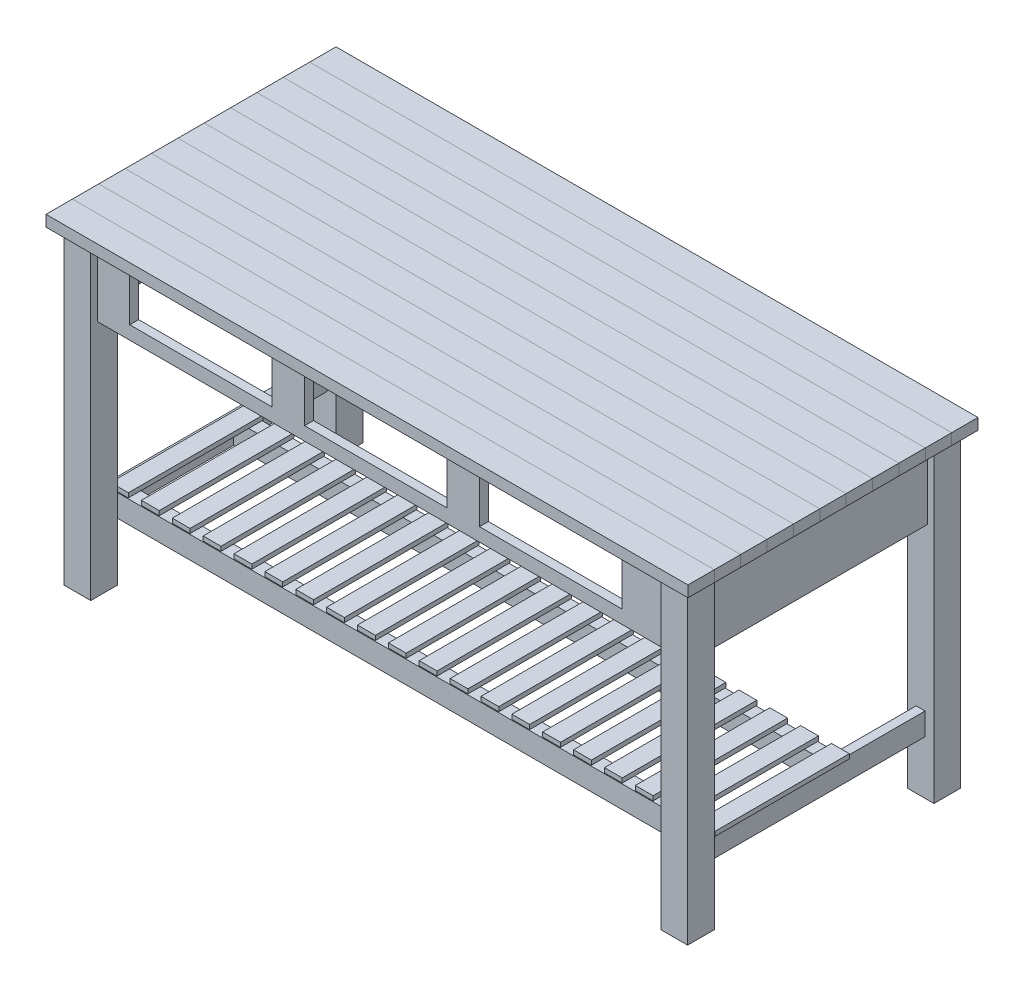
from build123d import *

# Parameters (mm, degrees)
SKETCH1_W                      = 1830.3875
SKETCH1_H                      = 75.184
TOP1_DEPTH                     = 31.75
SKETCH1_9_W                    = 1830.3875
SKETCH1_9_H                    = 75.184
TOP2_DEPTH                     = 31.75
SKETCH1_10_W                   = 1830.3875
SKETCH1_10_H                   = 75.184
TOP3_DEPTH                     = 31.75
SKETCH1_11_W                   = 1830.3875
SKETCH1_11_H                   = 75.184
TOP4_DEPTH                     = 31.75
SKETCH1_12_W                   = 1830.3875
SKETCH1_12_H                   = 75.184
TOP5_DEPTH                     = 31.75
SKETCH1_13_W                   = 1830.3875
SKETCH1_13_H                   = 75.184
TOP6_DEPTH                     = 31.75
SKETCH1_14_W                   = 1830.3875
SKETCH1_14_H                   = 75.184
TOP7_DEPTH                     = 31.75
SKETCH1_15_W                   = 1830.3875
SKETCH1_15_H                   = 75.184
TOP8_DEPTH                     = 31.75
SKETCH1_16_W                   = 1830.3875
SKETCH1_16_H                   = 75.184
TOP9_DEPTH                     = 31.75
SKETCH1_17_W                   = 1830.3875
SKETCH1_17_H                   = 75.184
TOP10_DEPTH                    = 31.75
SKETCH1_20_W                   = 1830.3875
SKETCH1_20_H                   = 75.184
TOP11_DEPTH                    = 31.75
SKETCH2_W                      = 76.2
SKETCH2_H                      = 76.2
TABLE_LEGS_DEPTH               = 882.65
TABLE_LEGS_2_DEPTH             = 882.65
TABLE_LEGS_3_DEPTH             = 882.65
TABLE_LEGS_4_DEPTH             = 882.65
SKETCH4_W                      = 25.4
SKETCH4_H                      = 63.5
STRETCHER_WIDTH_DEPTH          = 624.84
SKETCH5_W                      = 38.1
SKETCH5_H                      = 63.5
STRETCHER_LENGTH_DEPTH         = 1679.575
STRETCHER_LENGTH_2_DEPTH       = 1679.575
SKETCH7_W                      = 25.4
SKETCH7_H                      = 203.2
FRONT_FACE_PLATE_DEPTH         = 1625.6
SKETCH8_W                      = 25.4
SKETCH8_H                      = 203.2
SIDE_FACE_PLATES_DEPTH         = 624.84
SIDE_FACE_PLATES_2_DEPTH       = 624.84
SKETCH9_W                      = 50.8
SKETCH9_H                      = 12.7
STRETCHER_RACK_BOARDS_DEPTH    = 383.54
STRETCHER_RACK_BOARDS_2_DEPTH  = 383.54
STRETCHER_RACK_BOARDS_3_DEPTH  = 383.54
STRETCHER_RACK_BOARDS_4_DEPTH  = 383.54
STRETCHER_RACK_BOARDS_5_DEPTH  = 383.54
STRETCHER_RACK_BOARDS_6_DEPTH  = 383.54
STRETCHER_RACK_BOARDS_7_DEPTH  = 383.54
STRETCHER_RACK_BOARDS_8_DEPTH  = 383.54
STRETCHER_RACK_BOARDS_9_DEPTH  = 383.54
STRETCHER_RACK_BOARDS_10_DEPTH = 383.54
STRETCHER_RACK_BOARDS_11_DEPTH = 383.54
STRETCHER_RACK_BOARDS_12_DEPTH = 383.54
STRETCHER_RACK_BOARDS_13_DEPTH = 383.54
STRETCHER_RACK_BOARDS_14_DEPTH = 383.54
STRETCHER_RACK_BOARDS_15_DEPTH = 383.54
STRETCHER_RACK_BOARDS_16_DEPTH = 383.54
STRETCHER_RACK_BOARDS_17_DEPTH = 383.54
STRETCHER_RACK_BOARDS_18_DEPTH = 383.54
STRETCHER_RACK_BOARDS_19_DEPTH = 383.54
STRETCHER_RACK_BOARDS_20_DEPTH = 383.54
SKETCH10_W                     = 406.4
SKETCH10_H                     = 127
DRAWER_CUT_OUTS_DEPTH          = 25.4
SKETCH11_W                     = 25.4
SKETCH11_H                     = 101.6
BACK_FACE_PLATE_DEPTH          = 1628.775


with BuildPart() as part:
    # Sketch1 → top1 (new body)
    with BuildSketch(Plane(origin=(0, 0, 0), x_dir=(1, 0, 0), z_dir=(0, 1, 0))):
        with Locations((-0.79375, -99.862967742)):
            Rectangle(SKETCH1_W, SKETCH1_H)
    extrude(amount=TOP1_DEPTH)


with BuildPart() as body_2:
    # Sketch1<9> → top2 (new body)
    with BuildSketch(Plane(origin=(0, 0, 0), x_dir=(1, 0, 0), z_dir=(0, 1, 0))):
        with Locations((-0.79375, -24.678967742)):
            Rectangle(SKETCH1_9_W, SKETCH1_9_H)
    extrude(amount=TOP2_DEPTH)


with BuildPart() as body_3:
    # Sketch1<10> → top3 (new body)
    with BuildSketch(Plane(origin=(0, 0, 0), x_dir=(1, 0, 0), z_dir=(0, 1, 0))):
        with Locations((-0.79375, 50.505032258)):
            Rectangle(SKETCH1_10_W, SKETCH1_10_H)
    extrude(amount=TOP3_DEPTH)


with BuildPart() as body_4:
    # Sketch1<11> → top4 (new body)
    with BuildSketch(Plane(origin=(0, 0, 0), x_dir=(1, 0, 0), z_dir=(0, 1, 0))):
        with Locations((-0.79375, 125.689032258)):
            Rectangle(SKETCH1_11_W, SKETCH1_11_H)
    extrude(amount=TOP4_DEPTH)


with BuildPart() as body_5:
    # Sketch1<12> → top5 (new body)
    with BuildSketch(Plane(origin=(0, 0, 0), x_dir=(1, 0, 0), z_dir=(0, 1, 0))):
        with Locations((-0.79375, 200.873032258)):
            Rectangle(SKETCH1_12_W, SKETCH1_12_H)
    extrude(amount=TOP5_DEPTH)


with BuildPart() as body_6:
    # Sketch1<13> → top6 (new body)
    with BuildSketch(Plane(origin=(0, 0, 0), x_dir=(1, 0, 0), z_dir=(0, 1, 0))):
        with Locations((-0.79375, 276.057032258)):
            Rectangle(SKETCH1_13_W, SKETCH1_13_H)
    extrude(amount=TOP6_DEPTH)


with BuildPart() as body_7:
    # Sketch1<14> → top7 (new body)
    with BuildSketch(Plane(origin=(0, 0, 0), x_dir=(1, 0, 0), z_dir=(0, 1, 0))):
        with Locations((-0.79375, 351.241032258)):
            Rectangle(SKETCH1_14_W, SKETCH1_14_H)
    extrude(amount=TOP7_DEPTH)


with BuildPart() as body_8:
    # Sketch1<15> → top8 (new body)
    with BuildSketch(Plane(origin=(0, 0, 0), x_dir=(1, 0, 0), z_dir=(0, 1, 0))):
        with Locations((-0.79375, 426.425032258)):
            Rectangle(SKETCH1_15_W, SKETCH1_15_H)
    extrude(amount=TOP8_DEPTH)


with BuildPart() as body_9:
    # Sketch1<16> → top9 (new body)
    with BuildSketch(Plane(origin=(0, 0, 0), x_dir=(1, 0, 0), z_dir=(0, 1, 0))):
        with Locations((-0.79375, 501.609032258)):
            Rectangle(SKETCH1_16_W, SKETCH1_16_H)
    extrude(amount=TOP9_DEPTH)


with BuildPart() as body_10:
    # Sketch1<17> → top10 (new body)
    with BuildSketch(Plane(origin=(0, 0, 0), x_dir=(1, 0, 0), z_dir=(0, 1, 0))):
        with Locations((-0.79375, 576.793032258)):
            Rectangle(SKETCH1_17_W, SKETCH1_17_H)
    extrude(amount=TOP10_DEPTH)


with BuildPart() as body_11:
    # Sketch1<20> → top11 (new body)
    with BuildSketch(Plane(origin=(0, 0, 0), x_dir=(1, 0, 0), z_dir=(0, 1, 0))):
        with Locations((-0.79375, 651.977032258)):
            Rectangle(SKETCH1_20_W, SKETCH1_20_H)
    extrude(amount=TOP11_DEPTH)


with BuildPart() as body_12:
    # Sketch2 → table legs (new body)
    with BuildSketch(Plane(origin=(0, 0, 0), x_dir=(1, 0, 0), z_dir=(0, 1, 0))):
        with Locations((-850.9, -74.970967742)):
            Rectangle(SKETCH2_W, SKETCH2_H)
    extrude(amount=-TABLE_LEGS_DEPTH)


with BuildPart() as body_13:
    # Sketch2 → table legs 2 (new body)
    with BuildSketch(Plane(origin=(0, 0, 0), x_dir=(1, 0, 0), z_dir=(0, 1, 0))):
        with Locations((-852.4875, 626.069032258)):
            Rectangle(SKETCH2_W, SKETCH2_H)
    extrude(amount=-TABLE_LEGS_2_DEPTH)


with BuildPart() as body_14:
    # Sketch2 → table legs 3 (new body)
    with BuildSketch(Plane(origin=(0, 0, 0), x_dir=(1, 0, 0), z_dir=(0, 1, 0))):
        with Locations((852.4875, 626.069032258)):
            Rectangle(SKETCH2_W, SKETCH2_H)
    extrude(amount=-TABLE_LEGS_3_DEPTH)


with BuildPart() as body_15:
    # Sketch2 → table legs 4 (new body)
    with BuildSketch(Plane(origin=(0, 0, 0), x_dir=(1, 0, 0), z_dir=(0, 1, 0))):
        with Locations((850.9, -74.970967742)):
            Rectangle(SKETCH2_W, SKETCH2_H)
    extrude(amount=-TABLE_LEGS_4_DEPTH)


with BuildPart() as body_16:
    # Sketch4 → stretcher width (new body)
    with BuildSketch(Plane.XY.offset(-587.969032258)):
        with Locations((852.4875, -698.5)):
            Rectangle(SKETCH4_W, SKETCH4_H)
    stretcher_width = extrude(amount=STRETCHER_WIDTH_DEPTH)


with BuildPart() as body_12_1:
    add(body_12.part)

    add(body_13.part)  # Mirror4 merges body 13
    # Mirror4: stretcher width across plane
    add(stretcher_width.mirror(Plane(origin=(0, 0, 0), x_dir=(0, 0, 1), z_dir=(1, 0, 0))))


with BuildPart() as body_16_2:
    # Sketch5 → stretcher length (new body)
    with BuildSketch(Plane(origin=(-839.7875, 0, 0), x_dir=(0, 0, -1), z_dir=(1, 0, 0))):
        with Locations((-5.120967742, -698.5)):
            Rectangle(SKETCH5_W, SKETCH5_H)
    extrude(amount=STRETCHER_LENGTH_DEPTH)


with BuildPart() as body_17:
    # Sketch5 → stretcher length 2 (new body)
    with BuildSketch(Plane(origin=(-839.7875, 0, 0), x_dir=(0, 0, -1), z_dir=(1, 0, 0))):
        with Locations((340.319032258, -698.5)):
            Rectangle(SKETCH5_W, SKETCH5_H)
    extrude(amount=STRETCHER_LENGTH_2_DEPTH)


with BuildPart() as body_18:
    # Sketch7 → front face plate (new body)
    with BuildSketch(Plane(origin=(-812.8, 0, 0), x_dir=(0, 0, -1), z_dir=(1, 0, 0))):
        with Locations((-81.320967742, -101.6)):
            Rectangle(SKETCH7_W, SKETCH7_H)
    extrude(amount=FRONT_FACE_PLATE_DEPTH)

    # Sketch10 → drawer cut outs (cut)
    with BuildSketch(Plane.XY.offset(94.020967742)):
        with Locations((-517.525, -101.6)):
            Rectangle(SKETCH10_W, SKETCH10_H)
        with Locations((-18.923, -101.6)):
            Rectangle(SKETCH10_W, SKETCH10_H)
        with Locations((479.679, -101.6)):
            Rectangle(SKETCH10_W, SKETCH10_H)
    extrude(amount=-DRAWER_CUT_OUTS_DEPTH, mode=Mode.SUBTRACT)


with BuildPart() as body_19:
    # Sketch8 → side face plates (new body)
    with BuildSketch(Plane.XY.offset(-587.969032258)):
        with Locations((858.8375, -101.6)):
            Rectangle(SKETCH8_W, SKETCH8_H)
    extrude(amount=SIDE_FACE_PLATES_DEPTH)


with BuildPart() as body_20:
    # Sketch8 → side face plates 2 (new body)
    with BuildSketch(Plane.XY.offset(-587.969032258)):
        with Locations((-858.8375, -101.6)):
            Rectangle(SKETCH8_W, SKETCH8_H)
    extrude(amount=SIDE_FACE_PLATES_2_DEPTH)


with BuildPart() as body_21:
    # Sketch9 → stretcher rack boards (new body)
    with BuildSketch(Plane(origin=(0, 0, -359.369032258), x_dir=(-1, 0, 0), z_dir=(0, 0, -1))):
        with Locations((-764.404165617, -658.053375253)):
            Rectangle(SKETCH9_W, SKETCH9_H)
    extrude(amount=-STRETCHER_RACK_BOARDS_DEPTH)


with BuildPart() as body_22:
    # Sketch9 → stretcher rack boards 2 (new body)
    with BuildSketch(Plane(origin=(0, 0, -359.369032258), x_dir=(-1, 0, 0), z_dir=(0, 0, -1))):
        with Locations((-852.415165617, -658.053375253)):
            Rectangle(SKETCH9_W, SKETCH9_H)
    extrude(amount=-STRETCHER_RACK_BOARDS_2_DEPTH)


with BuildPart() as body_23:
    # Sketch9 → stretcher rack boards 3 (new body)
    with BuildSketch(Plane(origin=(0, 0, -359.369032258), x_dir=(-1, 0, 0), z_dir=(0, 0, -1))):
        with Locations((-676.393165617, -658.053375253)):
            Rectangle(SKETCH9_W, SKETCH9_H)
    extrude(amount=-STRETCHER_RACK_BOARDS_3_DEPTH)


with BuildPart() as body_24:
    # Sketch9 → stretcher rack boards 4 (new body)
    with BuildSketch(Plane(origin=(0, 0, -359.369032258), x_dir=(-1, 0, 0), z_dir=(0, 0, -1))):
        with Locations((-588.382165617, -658.053375253)):
            Rectangle(SKETCH9_W, SKETCH9_H)
    extrude(amount=-STRETCHER_RACK_BOARDS_4_DEPTH)


with BuildPart() as body_25:
    # Sketch9 → stretcher rack boards 5 (new body)
    with BuildSketch(Plane(origin=(0, 0, -359.369032258), x_dir=(-1, 0, 0), z_dir=(0, 0, -1))):
        with Locations((-500.371165617, -658.053375253)):
            Rectangle(SKETCH9_W, SKETCH9_H)
    extrude(amount=-STRETCHER_RACK_BOARDS_5_DEPTH)


with BuildPart() as body_26:
    # Sketch9 → stretcher rack boards 6 (new body)
    with BuildSketch(Plane(origin=(0, 0, -359.369032258), x_dir=(-1, 0, 0), z_dir=(0, 0, -1))):
        with Locations((-412.360165617, -658.053375253)):
            Rectangle(SKETCH9_W, SKETCH9_H)
    extrude(amount=-STRETCHER_RACK_BOARDS_6_DEPTH)


with BuildPart() as body_27:
    # Sketch9 → stretcher rack boards 7 (new body)
    with BuildSketch(Plane(origin=(0, 0, -359.369032258), x_dir=(-1, 0, 0), z_dir=(0, 0, -1))):
        with Locations((-324.349165617, -658.053375253)):
            Rectangle(SKETCH9_W, SKETCH9_H)
    extrude(amount=-STRETCHER_RACK_BOARDS_7_DEPTH)


with BuildPart() as body_28:
    # Sketch9 → stretcher rack boards 8 (new body)
    with BuildSketch(Plane(origin=(0, 0, -359.369032258), x_dir=(-1, 0, 0), z_dir=(0, 0, -1))):
        with Locations((-236.338165617, -658.053375253)):
            Rectangle(SKETCH9_W, SKETCH9_H)
    extrude(amount=-STRETCHER_RACK_BOARDS_8_DEPTH)


with BuildPart() as body_29:
    # Sketch9 → stretcher rack boards 9 (new body)
    with BuildSketch(Plane(origin=(0, 0, -359.369032258), x_dir=(-1, 0, 0), z_dir=(0, 0, -1))):
        with Locations((-148.327165617, -658.053375253)):
            Rectangle(SKETCH9_W, SKETCH9_H)
    extrude(amount=-STRETCHER_RACK_BOARDS_9_DEPTH)


with BuildPart() as body_30:
    # Sketch9 → stretcher rack boards 10 (new body)
    with BuildSketch(Plane(origin=(0, 0, -359.369032258), x_dir=(-1, 0, 0), z_dir=(0, 0, -1))):
        with Locations((-60.316165617, -658.053375253)):
            Rectangle(SKETCH9_W, SKETCH9_H)
    extrude(amount=-STRETCHER_RACK_BOARDS_10_DEPTH)


with BuildPart() as body_31:
    # Sketch9 → stretcher rack boards 11 (new body)
    with BuildSketch(Plane(origin=(0, 0, -359.369032258), x_dir=(-1, 0, 0), z_dir=(0, 0, -1))):
        with Locations((27.694834383, -658.053375253)):
            Rectangle(SKETCH9_W, SKETCH9_H)
    extrude(amount=-STRETCHER_RACK_BOARDS_11_DEPTH)


with BuildPart() as body_32:
    # Sketch9 → stretcher rack boards 12 (new body)
    with BuildSketch(Plane(origin=(0, 0, -359.369032258), x_dir=(-1, 0, 0), z_dir=(0, 0, -1))):
        with Locations((115.705834383, -658.053375253)):
            Rectangle(SKETCH9_W, SKETCH9_H)
    extrude(amount=-STRETCHER_RACK_BOARDS_12_DEPTH)


with BuildPart() as body_33:
    # Sketch9 → stretcher rack boards 13 (new body)
    with BuildSketch(Plane(origin=(0, 0, -359.369032258), x_dir=(-1, 0, 0), z_dir=(0, 0, -1))):
        with Locations((203.716834383, -658.053375253)):
            Rectangle(SKETCH9_W, SKETCH9_H)
    extrude(amount=-STRETCHER_RACK_BOARDS_13_DEPTH)


with BuildPart() as body_34:
    # Sketch9 → stretcher rack boards 14 (new body)
    with BuildSketch(Plane(origin=(0, 0, -359.369032258), x_dir=(-1, 0, 0), z_dir=(0, 0, -1))):
        with Locations((291.727834383, -658.053375253)):
            Rectangle(SKETCH9_W, SKETCH9_H)
    extrude(amount=-STRETCHER_RACK_BOARDS_14_DEPTH)


with BuildPart() as body_35:
    # Sketch9 → stretcher rack boards 15 (new body)
    with BuildSketch(Plane(origin=(0, 0, -359.369032258), x_dir=(-1, 0, 0), z_dir=(0, 0, -1))):
        with Locations((379.738834383, -658.053375253)):
            Rectangle(SKETCH9_W, SKETCH9_H)
    extrude(amount=-STRETCHER_RACK_BOARDS_15_DEPTH)


with BuildPart() as body_36:
    # Sketch9 → stretcher rack boards 16 (new body)
    with BuildSketch(Plane(origin=(0, 0, -359.369032258), x_dir=(-1, 0, 0), z_dir=(0, 0, -1))):
        with Locations((467.749834383, -658.053375253)):
            Rectangle(SKETCH9_W, SKETCH9_H)
    extrude(amount=-STRETCHER_RACK_BOARDS_16_DEPTH)


with BuildPart() as body_37:
    # Sketch9 → stretcher rack boards 17 (new body)
    with BuildSketch(Plane(origin=(0, 0, -359.369032258), x_dir=(-1, 0, 0), z_dir=(0, 0, -1))):
        with Locations((555.760834383, -658.053375253)):
            Rectangle(SKETCH9_W, SKETCH9_H)
    extrude(amount=-STRETCHER_RACK_BOARDS_17_DEPTH)


with BuildPart() as body_38:
    # Sketch9 → stretcher rack boards 18 (new body)
    with BuildSketch(Plane(origin=(0, 0, -359.369032258), x_dir=(-1, 0, 0), z_dir=(0, 0, -1))):
        with Locations((643.771834383, -658.053375253)):
            Rectangle(SKETCH9_W, SKETCH9_H)
    extrude(amount=-STRETCHER_RACK_BOARDS_18_DEPTH)


with BuildPart() as body_39:
    # Sketch9 → stretcher rack boards 19 (new body)
    with BuildSketch(Plane(origin=(0, 0, -359.369032258), x_dir=(-1, 0, 0), z_dir=(0, 0, -1))):
        with Locations((731.782834383, -658.053375253)):
            Rectangle(SKETCH9_W, SKETCH9_H)
    extrude(amount=-STRETCHER_RACK_BOARDS_19_DEPTH)


with BuildPart() as body_40:
    # Sketch9 → stretcher rack boards 20 (new body)
    with BuildSketch(Plane(origin=(0, 0, -359.369032258), x_dir=(-1, 0, 0), z_dir=(0, 0, -1))):
        with Locations((819.793834383, -658.053375253)):
            Rectangle(SKETCH9_W, SKETCH9_H)
    extrude(amount=-STRETCHER_RACK_BOARDS_20_DEPTH)


with BuildPart() as body_41:
    # Sketch11 → back face plate (new body)
    with BuildSketch(Plane(origin=(-814.3875, 0, 0), x_dir=(0, 0, -1), z_dir=(1, 0, 0))):
        with Locations((632.419032258, -50.8)):
            Rectangle(SKETCH11_W, SKETCH11_H)
    extrude(amount=BACK_FACE_PLATE_DEPTH)


solid = Compound([part.part, body_2.part, body_3.part, body_4.part, body_5.part, body_6.part, body_7.part, body_8.part, body_9.part, body_10.part, body_11.part, body_14.part, body_15.part, body_16.part, body_12_1.part, body_16_2.part, body_17.part, body_18.part, body_19.part, body_20.part, body_21.part, body_22.part, body_23.part, body_24.part, body_25.part, body_26.part, body_27.part, body_28.part, body_29.part, body_30.part, body_31.part, body_32.part, body_33.part, body_34.part, body_35.part, body_36.part, body_37.part, body_38.part, body_39.part, body_40.part, body_41.part])
